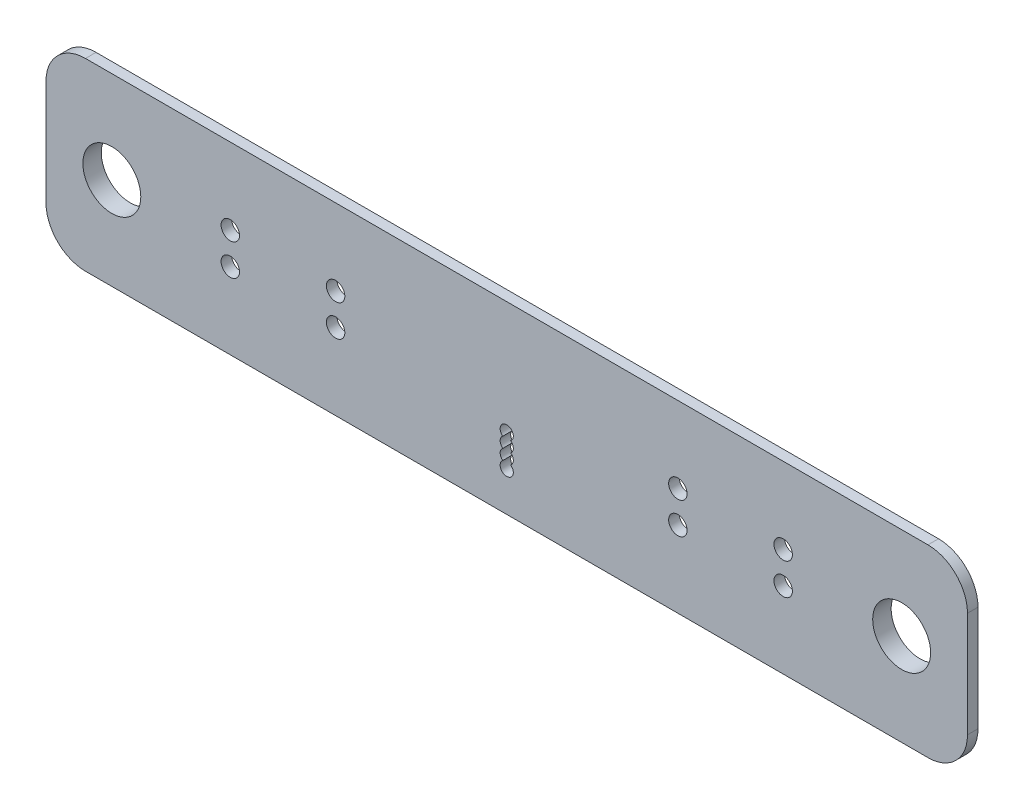
from build123d import *

# Parameters (mm, degrees)
SKETCH1_W           = 350
SKETCH1_H           = 70
BOSS_EXTRUDE1_DEPTH = 4
FILLET1_R           = 15
SKETCH2_R           = 11
CUT_EXTRUDE1_DEPTH  = 10
BOSS_EXTRUDE2_START = 3
SKETCH3_R           = 13.5
SKETCH3_R_2         = 11
BOSS_EXTRUDE2_DEPTH = 3
SKETCH4_R           = 3.5
CUT_EXTRUDE3_DEPTH  = 10


with BuildPart() as part:
    # Sketch1 → Boss-Extrude1 (new body)
    with BuildSketch(Plane.XY):
        Rectangle(SKETCH1_W, SKETCH1_H)
    extrude(amount=BOSS_EXTRUDE1_DEPTH)

    # Fillet1
    fillet1_edges = [part.edges().sort_by_distance(p)[0] for p in [
        (175, -35, 2),
        (-175, -35, 2),
        (-175, 35, 2),
        (175, 35, 2),
    ]]
    fillet(fillet1_edges, radius=FILLET1_R)

    # Sketch2 → Cut-Extrude1 (cut)
    with BuildSketch(Plane(origin=(0, 0, 0), x_dir=(-1, 0, 0), z_dir=(0, 0, -1))):
        with Locations((-150, 0)):
            Circle(SKETCH2_R)
    cut_extrude1 = extrude(amount=-CUT_EXTRUDE1_DEPTH, mode=Mode.SUBTRACT)

    # Sketch3 → Boss-Extrude2 (add)
    with BuildSketch(Plane(origin=(0, 0, 0), x_dir=(-1, 0, 0), z_dir=(0, 0, -1)).offset(BOSS_EXTRUDE2_START)):
        with Locations(Location((-150, 0, 0), (0, 0, 180))):
            Circle(SKETCH3_R)
        with Locations((-150, 0)):
            Circle(SKETCH3_R_2, mode=Mode.SUBTRACT)
    boss_extrude2 = extrude(amount=-BOSS_EXTRUDE2_DEPTH)

    # Mirror2: Cut-Extrude1, Boss-Extrude2 across plane
    add(cut_extrude1.mirror(Plane(origin=(0, 0, 0), x_dir=(0, 0, 1), z_dir=(1, 0, 0))), mode=Mode.SUBTRACT)
    add(boss_extrude2.mirror(Plane(origin=(0, 0, 0), x_dir=(0, 0, 1), z_dir=(1, 0, 0))))

    # Sketch4 → Cut-Extrude3 (cut)
    with BuildSketch(Plane.XY.offset(4)):
        with Locations((-105, 6)):
            Circle(SKETCH4_R)
        with Locations((-105, -6)):
            Circle(SKETCH4_R)
        with Locations((-65, -6)):
            Circle(SKETCH4_R)
        with Locations((-65, 6)):
            Circle(SKETCH4_R)
        with Locations((65, 6)):
            Circle(SKETCH4_R)
        with Locations((65, -6)):
            Circle(SKETCH4_R)
        with Locations((105, -6)):
            Circle(SKETCH4_R)
        with Locations((105, 6)):
            Circle(SKETCH4_R)
        with BuildLine():
            ThreePointArc((-1.5, -14), (-2.5, -12), (-1.5, -10))
            ThreePointArc((-1.5, -10), (0, -5.5), (1.5, -10))
            ThreePointArc((1.5, -10), (2.5, -12), (1.5, -14))
            ThreePointArc((1.5, -14), (2.5, -16), (1.5, -18))
            ThreePointArc((1.5, -18), (0, -22.5), (-1.5, -18))
            ThreePointArc((-1.5, -18), (-2.5, -16), (-1.5, -14))
        make_face()
    extrude(amount=-CUT_EXTRUDE3_DEPTH, mode=Mode.SUBTRACT)


solid = part.part
